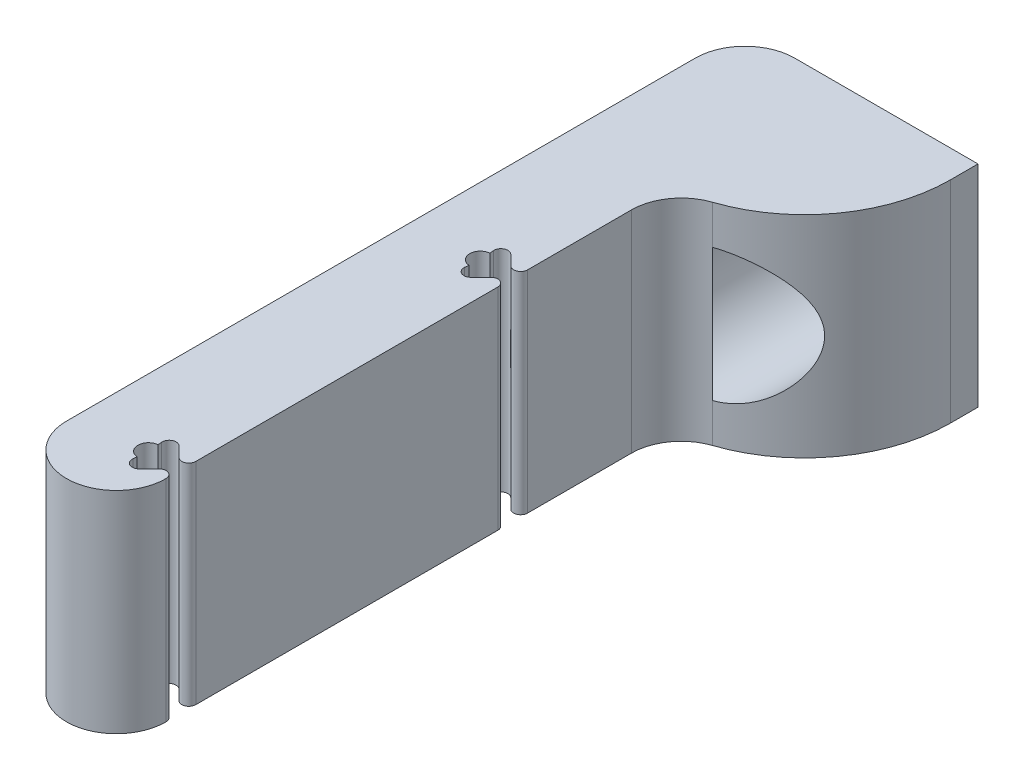
from build123d import *

# Parameters (mm, degrees)
BOSS_EXTRUDE1_DEPTH = 12.7
SKETCH2_R           = 4
CUT_EXTRUDE1_DEPTH  = 10


with BuildPart() as part:
    # Sketch1 → Boss-Extrude1 (new body)
    with BuildSketch(Plane(origin=(0, 0, 0), x_dir=(1, 0, 0), z_dir=(0, 1, 0))):
        with BuildLine():
            Line((-4.055343897, 0.632583633), (-4.075844459, 0.866906139))
            ThreePointArc((-4.075844459, 0.866906139), (-3.83530083, 1.283539926), (-3.361522369, 1.2))
            Line((-3.361522369, 1.2), (-2.761522369, 0.6))
            ThreePointArc((-2.761522369, 0.6), (-2.304491577, 0.509090923), (-2.04560443, 0.89654292))
            Line((-2.04560443, 0.89654292), (-2.04560443, 19.10345708))
            ThreePointArc((-2.04560443, 19.10345708), (-2.304491577, 19.490909077), (-2.761522369, 19.4))
            Line((-2.761522369, 19.4), (-3.361522369, 18.8))
            ThreePointArc((-3.361522369, 18.8), (-3.83530083, 18.716460074), (-4.075844459, 19.133093861))
            Line((-4.075844459, 19.133093861), (-4.055343897, 19.367416367))
            ThreePointArc((-4.055343897, 19.367416367), (-4.635, 20), (-4.055343897, 20.632583633))
            Line((-4.055343897, 20.632583633), (-4.075844459, 20.866906139))
            ThreePointArc((-4.075844459, 20.866906139), (-3.83530083, 21.283539926), (-3.361522369, 21.2))
            Line((-3.361522369, 21.2), (-2.761522369, 20.6))
            ThreePointArc((-2.761522369, 20.6), (-2.304491577, 20.509090923), (-2.04560443, 20.89654292))
            Line((-2.04560443, 20.89654292), (-2.04560443, 27.15586057))
            ThreePointArc((-2.04560443, 27.15586057), (-1.481090696, 28.90754737), (0, 30))
            ThreePointArc((0, 30), (4.34421438, 33.204292914), (6, 38.342197704))
            Line((6, 38.342197704), (6, 40))
            Line((6, 40), (-5.04560443, 40))
            ThreePointArc((-5.04560443, 40), (-7.166924773, 39.121320344), (-8.04560443, 37))
            Line((-8.04560443, 37), (-8.04560443, -0.89654292))
            ThreePointArc((-8.04560443, -0.89654292), (-5.04560443, -3.89654292), (-2.04560443, -0.89654292))
            ThreePointArc((-2.04560443, -0.89654292), (-2.304491577, -0.509090923), (-2.761522369, -0.6))
            Line((-2.761522369, -0.6), (-3.361522369, -1.2))
            ThreePointArc((-3.361522369, -1.2), (-3.83530083, -1.283539926), (-4.075844459, -0.866906139))
            Line((-4.075844459, -0.866906139), (-4.055343897, -0.632583633))
            ThreePointArc((-4.055343897, -0.632583633), (-4.635, 0), (-4.055343897, 0.632583633))
        make_face()
    extrude(amount=BOSS_EXTRUDE1_DEPTH)

    # Sketch2 → Cut-Extrude1 (cut)
    with BuildSketch(Plane(origin=(0, 0, -40), x_dir=(-1, 0, 0), z_dir=(0, 0, -1))):
        with Locations((0, 6.35)):
            Circle(SKETCH2_R)
    extrude(amount=-CUT_EXTRUDE1_DEPTH, mode=Mode.SUBTRACT)


solid = part.part
